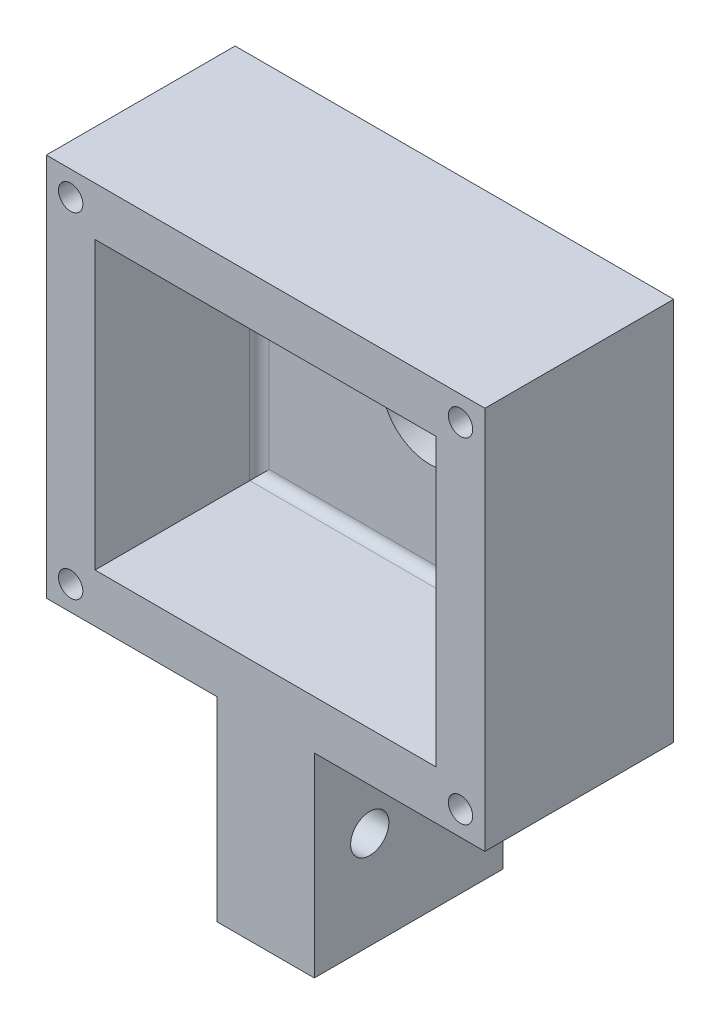
from build123d import *

# Parameters (mm, degrees)
SKETCH1_W           = 57.15
SKETCH1_H           = 50.00625
SKETCH1_W_2         = 44.45
SKETCH1_H_2         = 37.30625
BOSS_EXTRUDE1_DEPTH = 21.43125
SKETCH2_W           = 57.15
SKETCH2_H           = 50.00625
SKETCH2_R           = 6.35
BOSS_EXTRUDE2_DEPTH = 3.175
FILLET1_R           = 1.27
SKETCH6_R           = 1.5875
CUT_EXTRUDE2_DEPTH  = 9.525
SKETCH7_W           = 12.7
SKETCH7_H           = 24.60625
BOSS_EXTRUDE3_DEPTH = 25.4
CUT_EXTRUDE3_REACH  = 66.958
SKETCH8_R           = 2.4892


with BuildPart() as part:
    # Sketch1 → Boss-Extrude1 (new body)
    with BuildSketch(Plane.XY):
        Rectangle(SKETCH1_W, SKETCH1_H)
        Rectangle(SKETCH1_W_2, SKETCH1_H_2, mode=Mode.SUBTRACT)
    extrude(amount=BOSS_EXTRUDE1_DEPTH)

    # Sketch2 → Boss-Extrude2 (add)
    with BuildSketch(Plane.XY):
        Rectangle(SKETCH2_W, SKETCH2_H)
        Circle(SKETCH2_R, mode=Mode.SUBTRACT)
    extrude(amount=-BOSS_EXTRUDE2_DEPTH)

    # Fillet1
    fillet1_edges = [part.edges().sort_by_distance(p)[0] for p in [
        (-22.225, 0, 0),
        (0, -18.653125, 0),
        (22.225, 0, 0),
        (0, 18.653125, 0),
    ]]
    fillet(fillet1_edges, radius=FILLET1_R)

    # Sketch6 → Cut-Extrude2 (cut)
    with BuildSketch(Plane.XY.offset(21.43125)):
        with Locations((-25.4, 21.828125)):
            Circle(SKETCH6_R)
        with Locations((25.4, 21.828125)):
            Circle(SKETCH6_R)
        with Locations((25.4, -21.828125)):
            Circle(SKETCH6_R)
        with Locations((-25.4, -21.828125)):
            Circle(SKETCH6_R)
    extrude(amount=-CUT_EXTRUDE2_DEPTH, mode=Mode.SUBTRACT)

    # Sketch7 → Boss-Extrude3 (add)
    with BuildSketch(Plane.XZ.offset(25.003125)):
        with Locations((0, 9.128125)):
            Rectangle(SKETCH7_W, SKETCH7_H)
    extrude(amount=BOSS_EXTRUDE3_DEPTH)

    # Sketch8 → Cut-Extrude3 (cut, up to next)
    with BuildSketch(Plane.ZY.offset(6.35), mode=Mode.PRIVATE) as cut_extrude3_sk1:
        with Locations((4.048125, -37.703125)):
            Circle(SKETCH8_R)
    cut_extrude3_tool1 = extrude(cut_extrude3_sk1.sketch, amount=-CUT_EXTRUDE3_REACH, mode=Mode.PRIVATE) & part.part
    # Sketch8 → Cut-Extrude3 (cut, up to next)
    with BuildSketch(Plane.ZY.offset(6.35), mode=Mode.PRIVATE) as cut_extrude3_sk2:
        with Locations((14.208125, -37.703125)):
            Circle(SKETCH8_R)
    cut_extrude3_tool2 = extrude(cut_extrude3_sk2.sketch, amount=-CUT_EXTRUDE3_REACH, mode=Mode.PRIVATE) & part.part
    add(cut_extrude3_tool1.solids().sort_by_distance((-6.35, -37.703125, 4.048125))[0], mode=Mode.SUBTRACT)
    add(cut_extrude3_tool2.solids().sort_by_distance((-6.35, -37.703125, 14.208125))[0], mode=Mode.SUBTRACT)


solid = part.part
